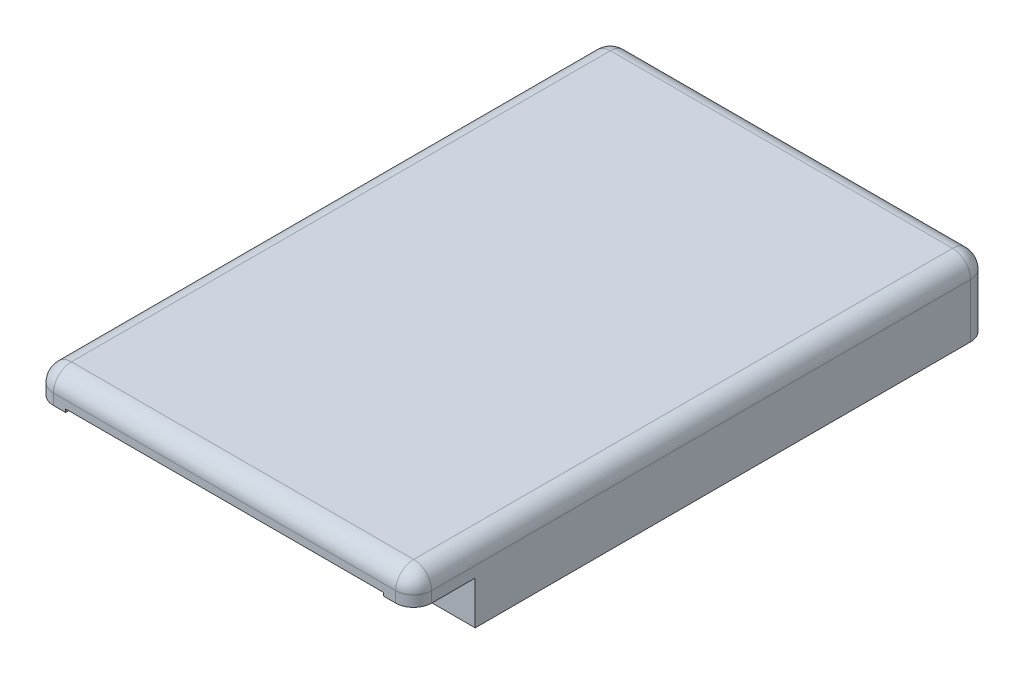
from build123d import *

# Parameters (mm, degrees)
BOSS_EXTRUDE1_DEPTH = 63.83
SKETCH2_W           = 42
SKETCH2_H           = 4.8
CUT_EXTRUDE1_DEPTH  = 6.83
FILLET1_R           = 2


with BuildPart() as part:
    # Sketch1 → Boss-Extrude1 (new body)
    with BuildSketch(Plane.XY):
        Polygon((-4.45, 5.15), (30.85, 5.15), (30.85, 2.35), (26.4, 2.35), (26.4, 0), (34.2, 0), (34.2, 8), (-7.8, 8), (-7.8, 0), (0, 0), (0, 2.35), (-4.45, 2.35), align=None)
    extrude(amount=BOSS_EXTRUDE1_DEPTH)

    # Sketch2 → Cut-Extrude1 (cut)
    with BuildSketch(Plane.XY.offset(63.83)):
        with Locations((13.2, 2.4)):
            Rectangle(SKETCH2_W, SKETCH2_H)
    extrude(amount=-CUT_EXTRUDE1_DEPTH, mode=Mode.SUBTRACT)

    # Fillet1
    fillet1_edges = [part.edges().sort_by_distance(p)[0] for p in [
        (-7.8, 4, 0),
        (13.2, 8, 0),
        (34.2, 4, 0),
        (-7.8, 8, 31.915),
        (34.2, 8, 31.915),
        (34.2, 6.4, 63.83),
        (13.2, 8, 63.83),
        (-7.8, 6.4, 63.83),
    ]]
    fillet(fillet1_edges, radius=FILLET1_R)


solid = part.part
